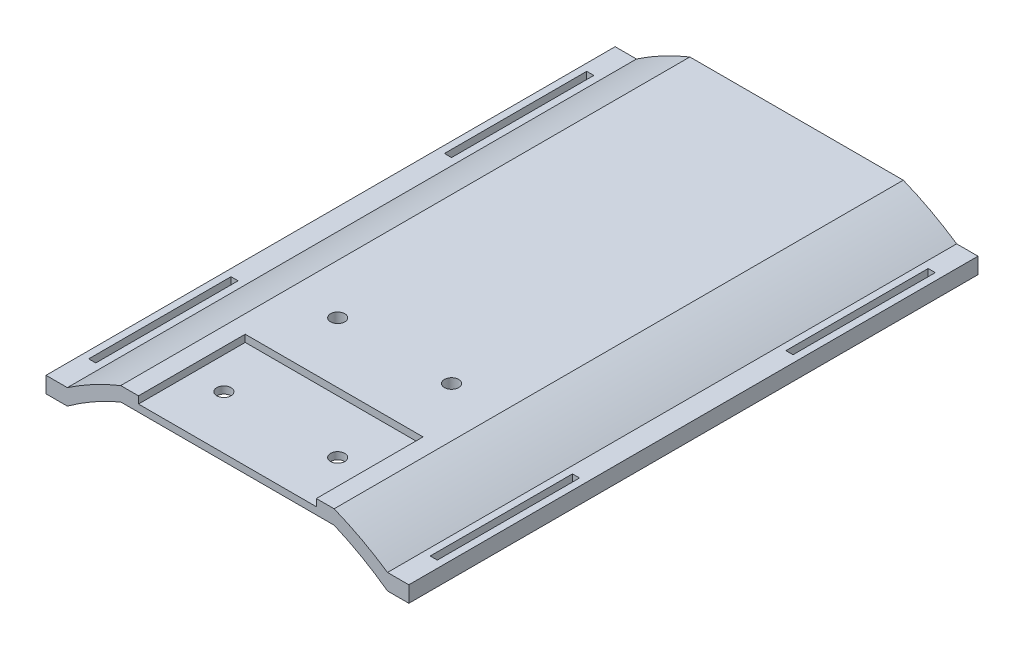
from build123d import *

# Parameters (mm, degrees)
BOSS_EXTRUDE1_DEPTH = 80
SKETCH8_W           = 25
SKETCH8_H           = 15
CUT_EXTRUDE2_DEPTH  = 1
SKETCH9_R           = 1
CUT_EXTRUDE3_DEPTH  = 1
SKETCH12_W          = 1
SKETCH12_H          = 20
CUT_EXTRUDE4_DEPTH  = 4.69
SKETCH13_R          = 1
CUT_EXTRUDE5_DEPTH  = 4.69


with BuildPart() as part:
    # Sketch4 → Boss-Extrude1 (new body)
    with BuildSketch(Plane.XY):
        with BuildLine():
            Line((-19.110677356, 53.885203774), (-16.110677356, 53.885203774))
            ThreePointArc((-16.110677356, 53.885203774), (-12.467042329, 56.084638099), (-8.610677356, 57.885203774))
            Line((-8.610677356, 57.885203774), (21.389322644, 57.885203774))
            ThreePointArc((21.389322644, 57.885203774), (25.245687617, 56.084638099), (28.889322644, 53.885203774))
            Line((28.889322644, 53.885203774), (31.889322644, 53.885203774))
            Line((31.889322644, 53.885203774), (31.889322644, 51.627366583))
            Line((31.889322644, 51.627366583), (28.889322644, 51.627366583))
            ThreePointArc((28.889322644, 51.627366583), (25.259796787, 53.968495283), (21.389322644, 55.885203774))
            Line((21.389322644, 55.885203774), (-8.610677356, 55.885203774))
            ThreePointArc((-8.610677356, 55.885203774), (-12.481151499, 53.968495283), (-16.110677356, 51.627366583))
            Line((-16.110677356, 51.627366583), (-19.110677356, 51.627366583))
            Line((-19.110677356, 51.627366583), (-19.110677356, 53.885203774))
        make_face()
    extrude(amount=BOSS_EXTRUDE1_DEPTH)

    # Sketch8 → Cut-Extrude2 (cut)
    with BuildSketch(Plane(origin=(0, 57.885203774, 0), x_dir=(1, 0, 0), z_dir=(0, 1, 0))):
        with Locations((6.389322644, -72.5)):
            Rectangle(SKETCH8_W, SKETCH8_H)
    extrude(amount=-CUT_EXTRUDE2_DEPTH, mode=Mode.SUBTRACT)

    # Sketch9 → Cut-Extrude3 (cut)
    with BuildSketch(Plane(origin=(0, 56.885203774, 0), x_dir=(1, 0, 0), z_dir=(0, 1, 0))):
        with Locations(Location((-1.610677356, -72.5, 0), (0, 0, 270))):
            Circle(SKETCH9_R)
        with Locations(Location((14.389322644, -72.5, 0), (0, 0, 270))):
            Circle(SKETCH9_R)
    extrude(amount=-CUT_EXTRUDE3_DEPTH, mode=Mode.SUBTRACT)

    # Sketch12 → Cut-Extrude4 (cut)
    with BuildSketch(Plane(origin=(0, 53.885203774, 0), x_dir=(1, 0, 0), z_dir=(0, 1, 0))):
        with Locations((-17.610677356, -15)):
            Rectangle(SKETCH12_W, SKETCH12_H)
        with Locations((-17.610677356, -65)):
            Rectangle(SKETCH12_W, SKETCH12_H)
        with Locations((30.389322644, -15)):
            Rectangle(SKETCH12_W, SKETCH12_H)
        with Locations((30.389322644, -65)):
            Rectangle(SKETCH12_W, SKETCH12_H)
    extrude(amount=-CUT_EXTRUDE4_DEPTH, mode=Mode.SUBTRACT)

    # Sketch13 → Cut-Extrude5 (cut)
    with BuildSketch(Plane(origin=(0, 57.885203774, 0), x_dir=(1, 0, 0), z_dir=(0, 1, 0))):
        with Locations(Location((-1.610677356, -56.5, 0), (0, 0, 270))):
            Circle(SKETCH13_R)
        with Locations(Location((14.389322644, -56.5, 0), (0, 0, 270))):
            Circle(SKETCH13_R)
    extrude(amount=-CUT_EXTRUDE5_DEPTH, mode=Mode.SUBTRACT)


solid = part.part
